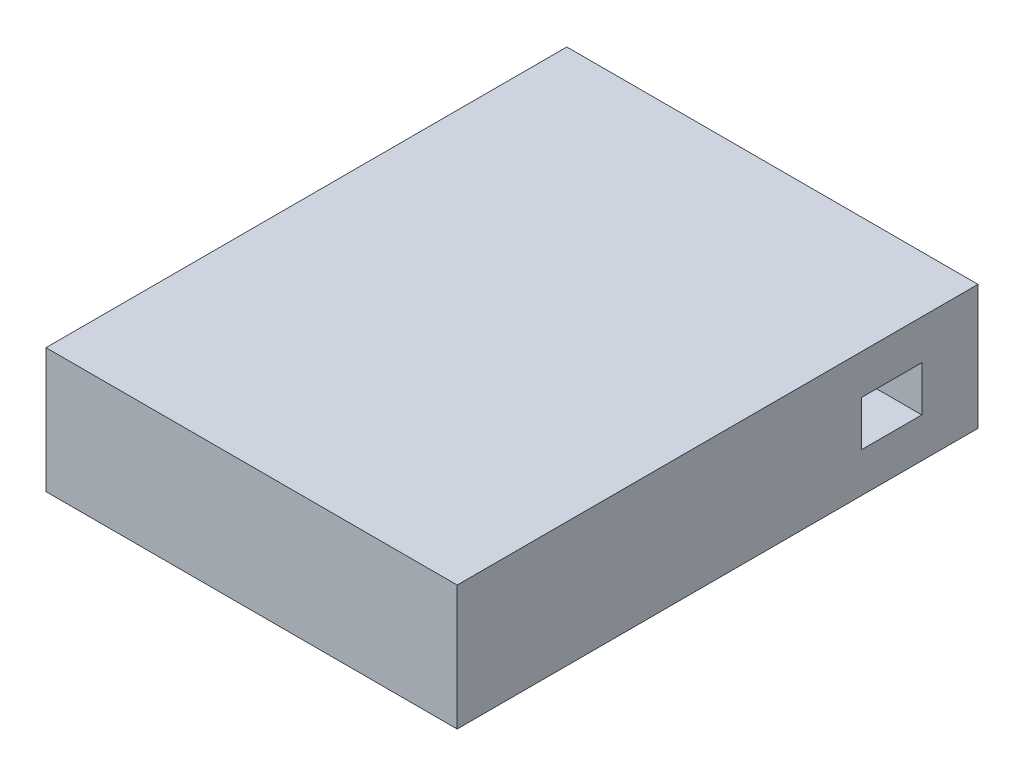
from build123d import *

# Parameters (mm, degrees)
SKETCH3_W           = 30
SKETCH3_H           = 38
BOSS_EXTRUDE1_DEPTH = 9.1
SKETCH4_W           = 4.4
SKETCH4_H           = 3.3
CUT_EXTRUDE1_DEPTH  = 46.1


with BuildPart() as part:
    # Sketch3 → Boss-Extrude1 (new body)
    with BuildSketch(Plane(origin=(0, 0, 0), x_dir=(1, 0, 0), z_dir=(0, 1, 0))):
        Rectangle(SKETCH3_W, SKETCH3_H)
    extrude(amount=BOSS_EXTRUDE1_DEPTH)

    # Sketch4 → Cut-Extrude1 (cut)
    with BuildSketch(Plane(origin=(15, 0, 0), x_dir=(0, 0, -1), z_dir=(1, 0, 0))):
        with Locations((12.7, 4.55)):
            Rectangle(SKETCH4_W, SKETCH4_H)
    extrude(amount=-CUT_EXTRUDE1_DEPTH, mode=Mode.SUBTRACT)


solid = part.part
